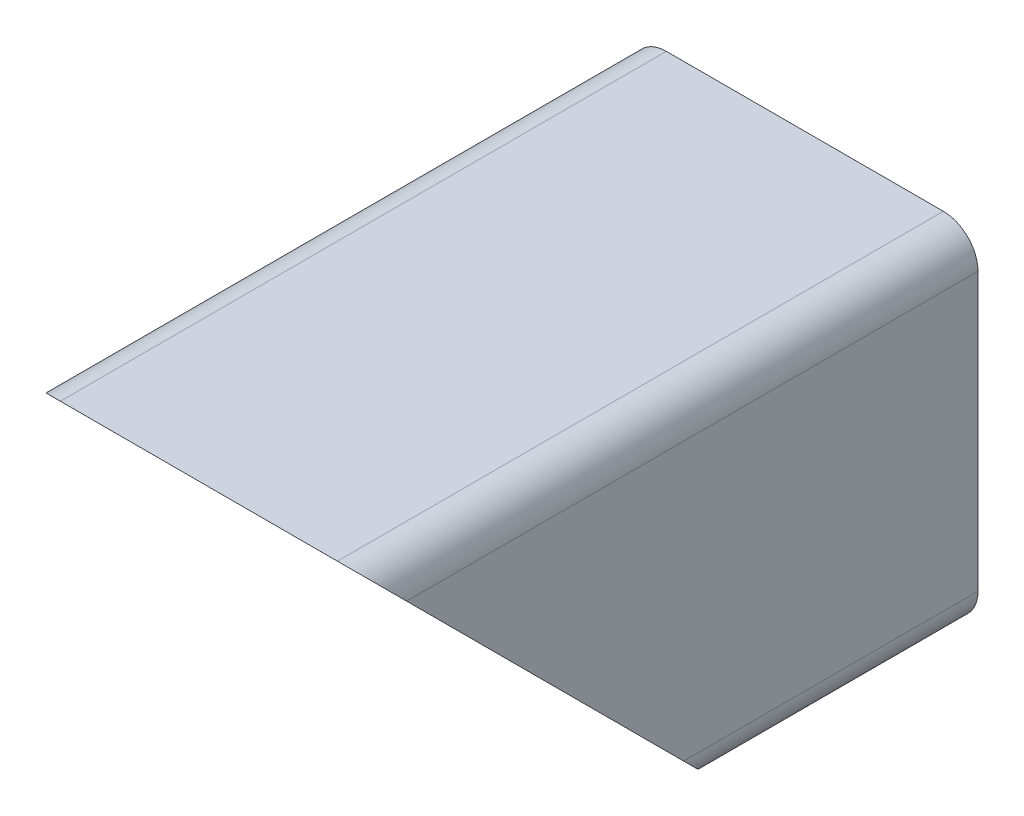
from build123d import *

# Parameters (mm, degrees)
Y_KSEKLIK_EKSTR_ZYON1_DEPTH = 70
KES_EKSTR_ZYON1_DEPTH       = 41
KES_EKSTR_ZYON1_DEPTH_BACK  = 43


with BuildPart() as part:
    # Çizim1 → Yükseklik-Ekstrüzyon1 (new body)
    with BuildSketch(Plane.XY):
        with BuildLine():
            Line((-16, 20), (16, 20))
            ThreePointArc((16, 20), (18.828427125, 18.828427125), (20, 16))
            Line((20, 16), (20, -16))
            ThreePointArc((20, -16), (18.828427125, -18.828427125), (16, -20))
            Line((16, -20), (-16, -20))
            ThreePointArc((-16, -20), (-18.828427125, -18.828427125), (-20, -16))
            Line((-20, -16), (-20, 16))
            ThreePointArc((-20, 16), (-18.828427125, 18.828427125), (-16, 20))
        make_face()
        with BuildLine():
            Line((-18, 16), (-18, -16))
            ThreePointArc((-18, -16), (-17.414213562, -17.414213562), (-16, -18))
            Line((-16, -18), (16, -18))
            ThreePointArc((16, -18), (17.414213562, -17.414213562), (18, -16))
            Line((18, -16), (18, 16))
            ThreePointArc((18, 16), (17.414213562, 17.414213562), (16, 18))
            Line((16, 18), (-16, 18))
            ThreePointArc((-16, 18), (-17.414213562, 17.414213562), (-18, 16))
        make_face(mode=Mode.SUBTRACT)
    extrude(amount=Y_KSEKLIK_EKSTR_ZYON1_DEPTH)

    # Çizim3 → Kes-Ekstrüzyon1 (cut, two sides: drawn at the far end of the back side and taken through both)
    with BuildSketch(Plane(origin=(0, 0, 0), x_dir=(0, 0, -1), z_dir=(1, 0, 0)).offset(-KES_EKSTR_ZYON1_DEPTH_BACK)):
        Polygon((-70, 20), (-30, -20), (-70, -20), align=None)
    extrude(amount=KES_EKSTR_ZYON1_DEPTH + KES_EKSTR_ZYON1_DEPTH_BACK, mode=Mode.SUBTRACT)


solid = part.part
